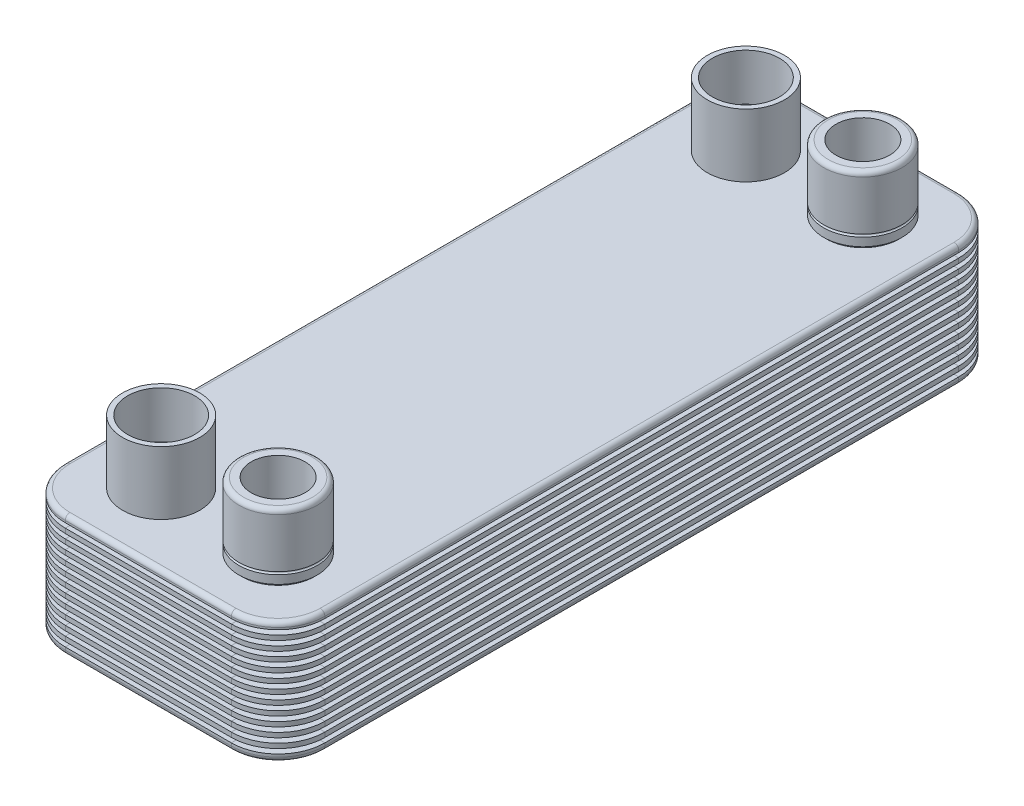
from build123d import *

# Parameters (mm, degrees)
BOSS_EXTRUDE1_DEPTH = 52
SKETCH2_W           = 6
SKETCH2_H           = 2
FILLET1_R           = 2


with BuildPart() as part:
    # Sketch1 → Boss-Extrude1 (new body)
    with BuildSketch(Plane(origin=(0, 0, 0), x_dir=(1, 0, 0), z_dir=(0, 1, 0))):
        with BuildLine():
            Line((-35.5, -155.5), (35.5, -155.5))
            ThreePointArc((35.5, -155.5), (49.642135624, -149.642135624), (55.5, -135.5))
            Line((55.5, -135.5), (55.5, 135.5))
            ThreePointArc((55.5, 135.5), (49.642135624, 149.642135624), (35.5, 155.5))
            Line((35.5, 155.5), (-35.5, 155.5))
            ThreePointArc((-35.5, 155.5), (-49.642135624, 149.642135624), (-55.5, 135.5))
            Line((-55.5, 135.5), (-55.5, -135.5))
            ThreePointArc((-55.5, -135.5), (-49.642135624, -149.642135624), (-35.5, -155.5))
        make_face()
    extrude(amount=BOSS_EXTRUDE1_DEPTH)

    # Cut-Sweep1: sweep along a path in Sketch3
    with BuildLine(Plane(origin=(0, 48.172504164, 0), x_dir=(1, 0, 0), z_dir=(0, 1, 0))) as cut_sweep1_path:
        Line((-35.5, -155.5), (35.5, -155.5))
        ThreePointArc((35.5, -155.5), (49.642135624, -149.642135624), (55.5, -135.5))
        Line((55.5, -135.5), (55.5, 135.5))
        ThreePointArc((55.5, 135.5), (49.642135624, 149.642135624), (35.5, 155.5))
        Line((35.5, 155.5), (-35.5, 155.5))
        ThreePointArc((-35.5, 155.5), (-49.642135624, 149.642135624), (-55.5, 135.5))
        Line((-55.5, 135.5), (-55.5, -135.5))
        ThreePointArc((-55.5, -135.5), (-49.642135624, -149.642135624), (-35.5, -155.5))
    # Sketch2 → Cut-Sweep1 (sweep, cut)
    with BuildSketch(Plane.XY.offset(135.5)):
        with Locations((-55.5, 48.172504164)):
            Rectangle(SKETCH2_W, SKETCH2_H)
        with Locations((-55.5, 44.172504164)):
            Rectangle(SKETCH2_W, SKETCH2_H)
        with Locations((-55.5, 40.172504164)):
            Rectangle(SKETCH2_W, SKETCH2_H)
        with Locations((-55.5, 36.172504164)):
            Rectangle(SKETCH2_W, SKETCH2_H)
        with Locations((-55.5, 32.172504164)):
            Rectangle(SKETCH2_W, SKETCH2_H)
        with Locations((-55.5, 28.172504164)):
            Rectangle(SKETCH2_W, SKETCH2_H)
        with Locations((-55.5, 24.172504164)):
            Rectangle(SKETCH2_W, SKETCH2_H)
        with Locations((-55.5, 20.172504164)):
            Rectangle(SKETCH2_W, SKETCH2_H)
        with Locations((-55.5, 16.172504164)):
            Rectangle(SKETCH2_W, SKETCH2_H)
        with Locations((-55.5, 12.172504164)):
            Rectangle(SKETCH2_W, SKETCH2_H)
        with Locations((-55.5, 8.172504164)):
            Rectangle(SKETCH2_W, SKETCH2_H)
        with Locations((-55.5, 4.172504164)):
            Rectangle(SKETCH2_W, SKETCH2_H)
    sweep(path=cut_sweep1_path.line, mode=Mode.SUBTRACT)

    # Fillet1
    fillet1_edges = [part.edges().sort_by_distance(p)[0] for p in [
        (49.642135624, 52, 149.642135624),
        (0, 0, 155.5),
        (-49.642135624, 0, 149.642135624),
        (55.5, 52, 0),
        (49.642135624, 52, -149.642135624),
        (0, 52, -155.5),
        (-49.642135624, 52, -149.642135624),
        (-55.5, 52, 0),
        (-49.642135624, 52, 149.642135624),
        (0, 52, 155.5),
        (-55.5, 0, 0),
        (-49.642135624, 0, -149.642135624),
        (0, 0, -155.5),
        (49.642135624, 0, -149.642135624),
        (55.5, 0, 0),
        (49.642135624, 0, 149.642135624),
    ]]
    fillet(fillet1_edges, radius=FILLET1_R)


with BuildPart() as body_2:
    # Sketch5 → Revolve1 (revolve)
    with BuildSketch(Plane(origin=(0, 0, -125), x_dir=(-1, 0, 0), z_dir=(0, 0, -1)), mode=Mode.PRIVATE) as revolve1_sk:
        Polygon((8.5, 52), (8.5, 79), (10.65, 79), (10.65, 59), (13.5, 59), (13.5, 52), align=None)
    revolve(revolve1_sk.sketch.rotate(Axis((-25, 52, -125), (0, 1, 0)), 90), axis=Axis((-25, 52, -125), (0, 1, 0)))


with BuildPart() as body_3:
    # Sketch6 → Revolve2 (revolve)
    with BuildSketch(Plane(origin=(0, 0, -125), x_dir=(-1, 0, 0), z_dir=(0, 0, -1)), mode=Mode.PRIVATE) as revolve2_sk:
        with BuildLine():
            Line((-36.5, 52), (-36.5, 81))
            Line((-36.5, 81), (-39.75, 81))
            ThreePointArc((-39.75, 81), (-41.164213562, 80.414213562), (-41.75, 79))
            Line((-41.75, 79), (-41.75, 57.855527537))
            ThreePointArc((-41.75, 57.855527537), (-41.194393429, 57.299920966), (-41.75, 56.744314395))
            Line((-41.75, 56.744314395), (-41.75, 53.172412131))
            Line((-41.75, 53.172412131), (-40.577587869, 53.172412131))
            Line((-40.577587869, 53.172412131), (-40.577587869, 52))
            Line((-40.577587869, 52), (-36.5, 52))
        make_face()
    revolve(revolve2_sk.sketch.rotate(Axis((25, 52, -125), (0, 1, 0)), 90), axis=Axis((25, 52, -125), (0, 1, 0)))


with BuildPart() as body_4:
    # Mirror1: mirrored copy
    add(body_3.part.mirror(Plane.XY))


with BuildPart() as body_5:
    # Mirror1 2: mirrored copy
    add(body_2.part.mirror(Plane.XY))


solid = Compound([part.part, body_2.part, body_3.part, body_4.part, body_5.part])
